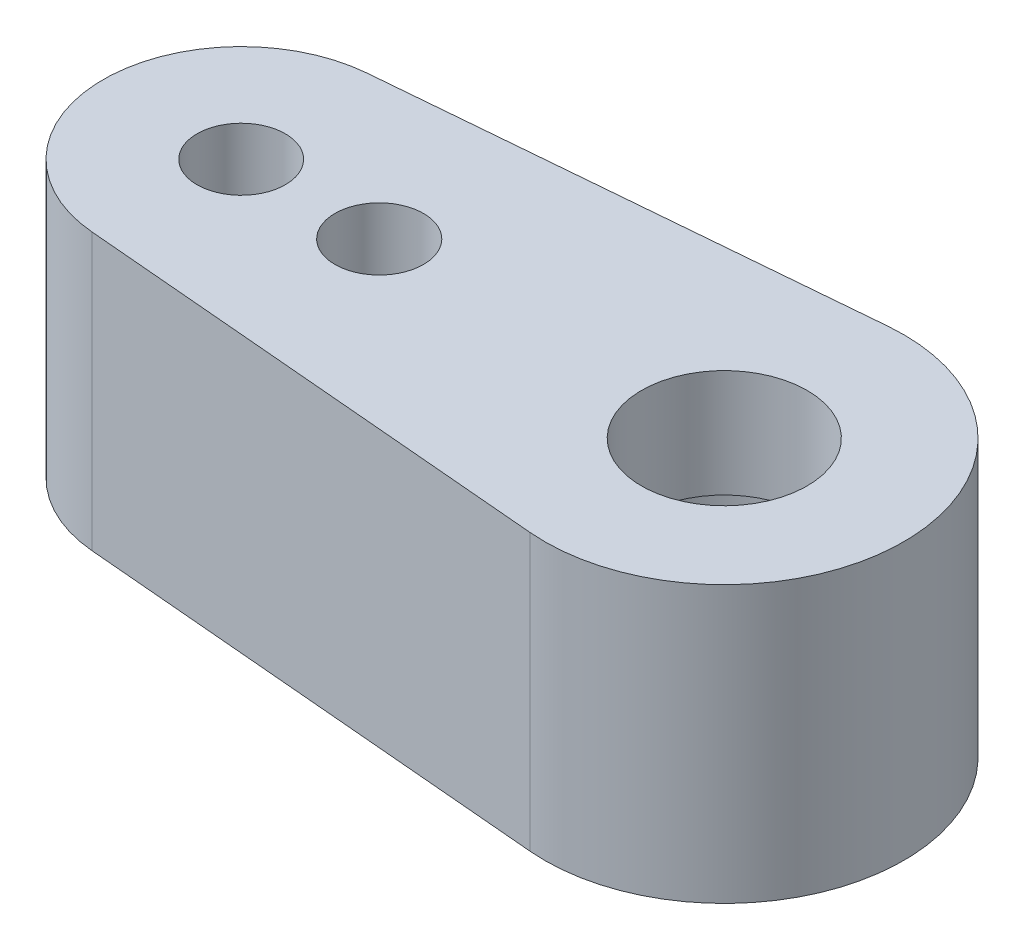
from build123d import *

# Parameters (mm, degrees)
BOSS_EXTRUDE1_DEPTH      = 1
BOSS_EXTRUDE1_DEPTH_BACK = 1
CUT_EXTRUDE1_REACH       = 7.093
SKETCH5_R                = 0.3207
SKETCH5_R_2              = 0.32


with BuildPart() as part:
    # Sketch1 → Boss-Extrude1 (new, two sides: drawn at the far end of the back side and taken through both)
    with BuildSketch(Plane(origin=(0, 0, 0), x_dir=(1, 0, 0), z_dir=(0, 1, 0)).offset(-BOSS_EXTRUDE1_DEPTH_BACK)):
        with BuildLine():
            Line((-3.585714286, 0.996319759), (-0.111428571, 1.295215686))
            ThreePointArc((-0.111428571, 1.295215686), (1.3, 0), (-0.111428571, -1.295215686))
            Line((-0.111428571, -1.295215686), (-3.585714286, -0.996319759))
            ThreePointArc((-3.585714286, -0.996319759), (-4.5, 0), (-3.585714286, 0.996319759))
        make_face()
    extrude(amount=BOSS_EXTRUDE1_DEPTH + BOSS_EXTRUDE1_DEPTH_BACK)

    # Sketch4 → Cut-Revolve1 (revolve, cut)
    with BuildSketch(Plane.XY):
        Polygon((0.85, 0), (0.85, 0.075), (0.6, 0.219337567), (0.6, 1), (0, 1), (0, -1), (0.6, -1), (0.6, -0.219337567), (0.85, -0.075), align=None)
    revolve(axis=Axis((0, -1, 0), (0, 1, 0)), mode=Mode.SUBTRACT)

    # Sketch5 → Cut-Extrude1 (cut, up to next)
    with BuildSketch(Plane(origin=(0, 1, 0), x_dir=(1, 0, 0), z_dir=(0, 1, 0)), mode=Mode.PRIVATE) as cut_extrude1_sk1:
        with Locations((-2.5, 0)):
            Circle(SKETCH5_R)
    cut_extrude1_tool1 = extrude(cut_extrude1_sk1.sketch, amount=-CUT_EXTRUDE1_REACH, mode=Mode.PRIVATE) & part.part
    # Sketch5 → Cut-Extrude1 (cut, up to next)
    with BuildSketch(Plane(origin=(0, 1, 0), x_dir=(1, 0, 0), z_dir=(0, 1, 0)), mode=Mode.PRIVATE) as cut_extrude1_sk2:
        with Locations((-3.5, 0)):
            Circle(SKETCH5_R_2)
    cut_extrude1_tool2 = extrude(cut_extrude1_sk2.sketch, amount=-CUT_EXTRUDE1_REACH, mode=Mode.PRIVATE) & part.part
    add(cut_extrude1_tool1.solids().sort_by_distance((-2.5, 1, 0))[0], mode=Mode.SUBTRACT)
    add(cut_extrude1_tool2.solids().sort_by_distance((-3.5, 1, 0))[0], mode=Mode.SUBTRACT)


solid = part.part
